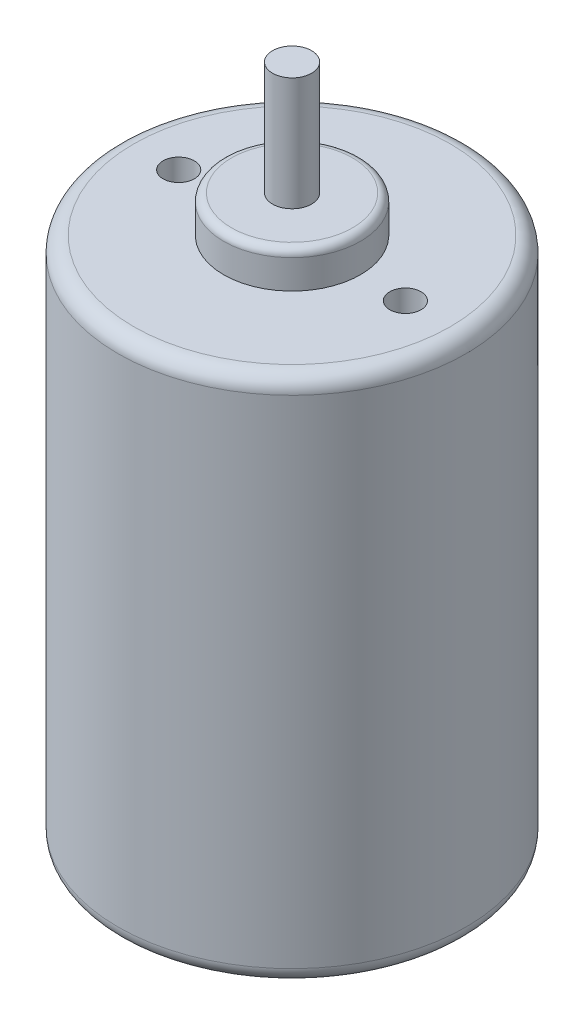
from build123d import *

# Parameters (mm, degrees)
SKETCH1_R           = 22.25
BOSS_EXTRUDE1_DEPTH = 67.5
SKETCH2_R           = 8.75
BOSS_EXTRUDE2_DEPTH = 4.7
SKETCH3_R           = 2.5
BOSS_EXTRUDE3_DEPTH = 14.5
SKETCH4_R           = 2
CUT_EXTRUDE1_DEPTH  = 14.5
FILLET1_R           = 2
FILLET2_R           = 1


with BuildPart() as part:
    # Sketch1 → Boss-Extrude1 (new body)
    with BuildSketch(Plane(origin=(0, 0, 0), x_dir=(1, 0, 0), z_dir=(0, 1, 0))):
        with Locations(Location((0, 0, 0), (0, 0, 270))):
            Circle(SKETCH1_R)
    extrude(amount=BOSS_EXTRUDE1_DEPTH)

    # Sketch2 → Boss-Extrude2 (add)
    with BuildSketch(Plane(origin=(0, 67.5, 0), x_dir=(1, 0, 0), z_dir=(0, 1, 0))):
        with Locations(Location((0, 0, 0), (0, 0, 270))):
            Circle(SKETCH2_R)
    extrude(amount=BOSS_EXTRUDE2_DEPTH)

    # Sketch3 → Boss-Extrude3 (add)
    with BuildSketch(Plane(origin=(0, 72.2, 0), x_dir=(1, 0, 0), z_dir=(0, 1, 0))):
        with Locations(Location((0, 0, 0), (0, 0, 90))):
            Circle(SKETCH3_R)
    extrude(amount=BOSS_EXTRUDE3_DEPTH)

    # Sketch4 → Cut-Extrude1 (cut)
    with BuildSketch(Plane(origin=(0, 67.5, 0), x_dir=(1, 0, 0), z_dir=(0, 1, 0))):
        with Locations(Location((14.5, 0, 0), (0, 0, 270))):
            Circle(SKETCH4_R)
        with Locations(Location((-14.5, 0, 0), (0, 0, 270))):
            Circle(SKETCH4_R)
    extrude(amount=-CUT_EXTRUDE1_DEPTH, mode=Mode.SUBTRACT)

    # Fillet1
    fillet1_edges = [part.edges().sort_by_distance(p)[0] for p in [
        (0, 0, -22.25),
        (0, 67.5, -22.25),
    ]]
    fillet(fillet1_edges, radius=FILLET1_R)

    # Fillet2
    fillet2_edges = [part.edges().sort_by_distance(p)[0] for p in [
        (0, 72.2, -8.75),
    ]]
    fillet(fillet2_edges, radius=FILLET2_R)


solid = part.part
